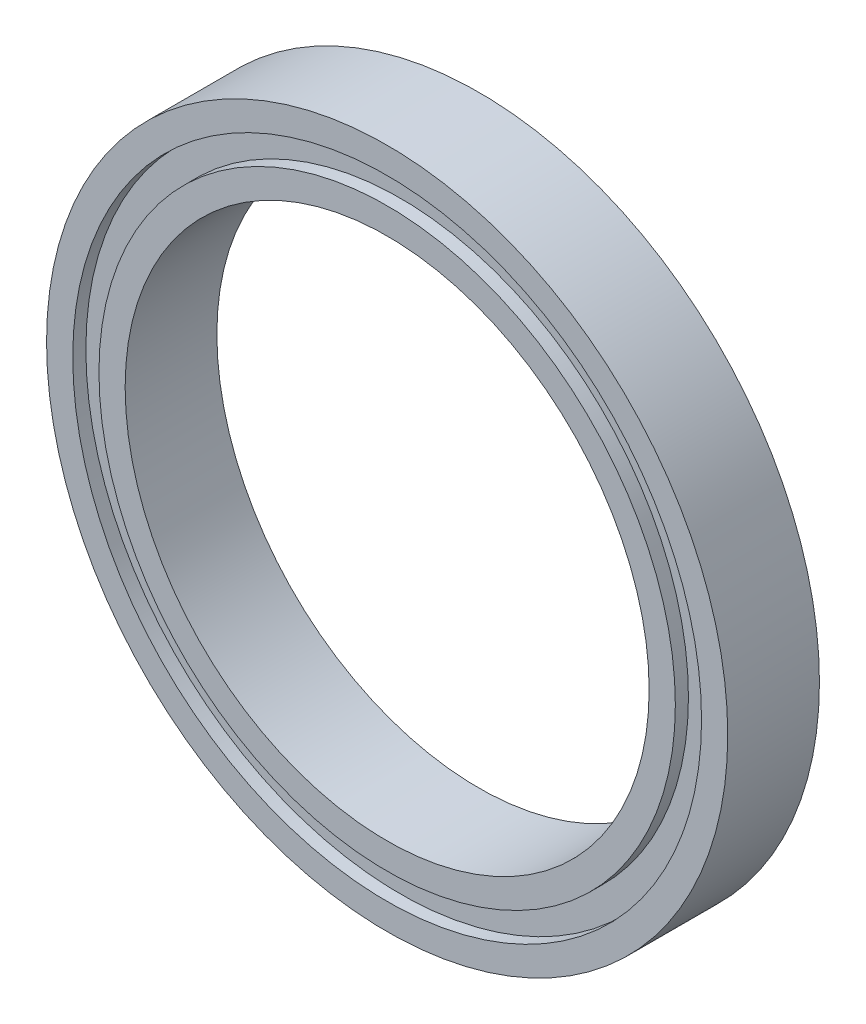
from build123d import *

# Parameters (mm, degrees)
EXTRUDE_1_DEPTH      = 3.5
EXTRUDE_1_DEPTH_BACK = 3.5
SKETCH_1_R           = 26
SKETCH_1_R_2         = 20
SKETCH_2_R           = 24
SKETCH_2_R_2         = 22
CUT_EXTRUDE_1_DEPTH  = 1


with BuildPart() as part:
    # 草图1 → 拉伸1 (new, two sides: drawn at the far end of the back side and taken through both)
    with BuildSketch(Plane.XY.offset(-EXTRUDE_1_DEPTH_BACK)):
        Circle(SKETCH_1_R)
        Circle(SKETCH_1_R_2, mode=Mode.SUBTRACT)
    extrude(amount=EXTRUDE_1_DEPTH + EXTRUDE_1_DEPTH_BACK)

    # 草图2 → 切除-拉伸1 (cut)
    with BuildSketch(Plane.XY.offset(3.5)):
        Circle(SKETCH_2_R)
        Circle(SKETCH_2_R_2, mode=Mode.SUBTRACT)
    cut_extrude_1 = extrude(amount=-CUT_EXTRUDE_1_DEPTH, mode=Mode.SUBTRACT)

    # 镜向1: 切除-拉伸1 across plane
    add(cut_extrude_1.mirror(Plane.XY), mode=Mode.SUBTRACT)


solid = part.part
